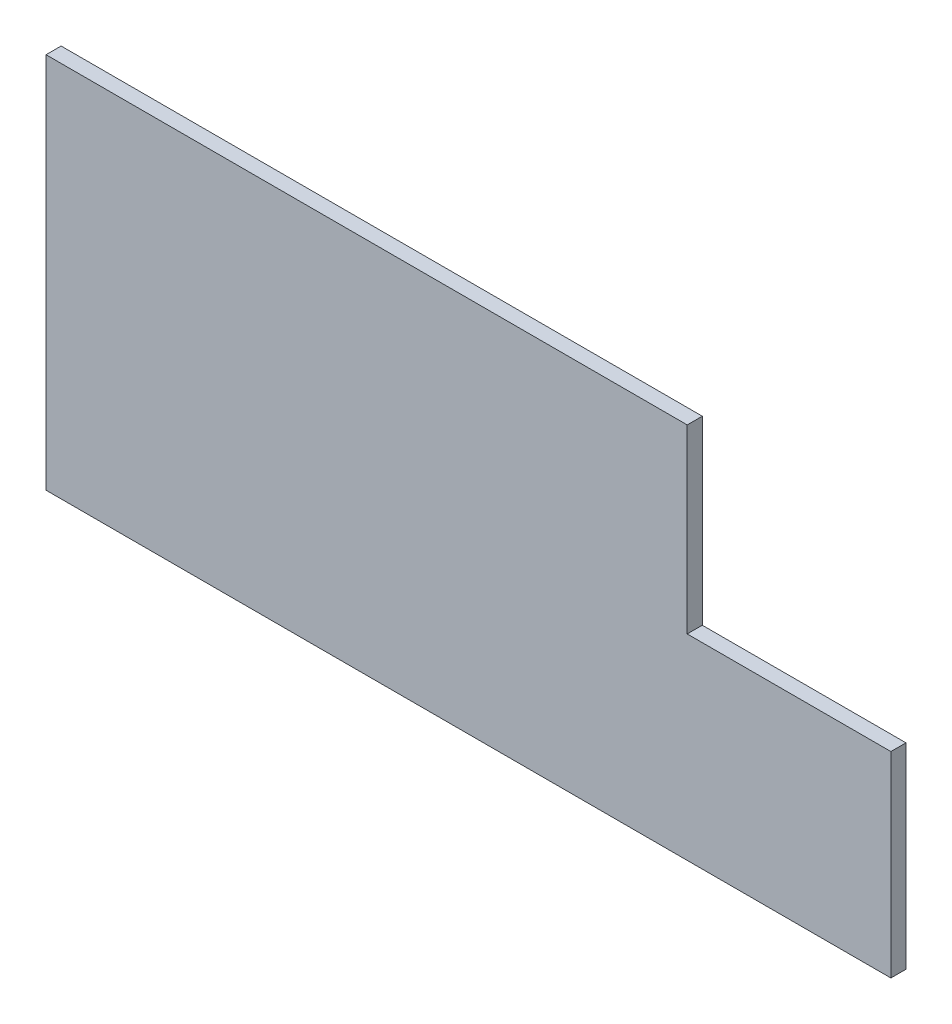
from build123d import *

# Parameters (mm, degrees)
ESQUISSE1_W        = 170
ESQUISSE1_H        = 100
BOSS_EXTRU_1_DEPTH = 4
ESQUISSE2_W        = 4
ESQUISSE2_H        = 52
BOSS_EXTRU_2_DEPTH = 54


with BuildPart() as part:
    # Esquisse1 → Boss.-Extru.1 (new body)
    with BuildSketch(Plane.XY):
        with Locations((-18.588292944, -1.358695652)):
            Rectangle(ESQUISSE1_W, ESQUISSE1_H)
    extrude(amount=BOSS_EXTRU_1_DEPTH)

    # Esquisse2 → Boss.-Extru.2 (add)
    with BuildSketch(Plane(origin=(66.411707056, 0, 0), x_dir=(0, 0, -1), z_dir=(1, 0, 0))):
        with Locations((-2, -25.358695652)):
            Rectangle(ESQUISSE2_W, ESQUISSE2_H)
    extrude(amount=BOSS_EXTRU_2_DEPTH)


solid = part.part
